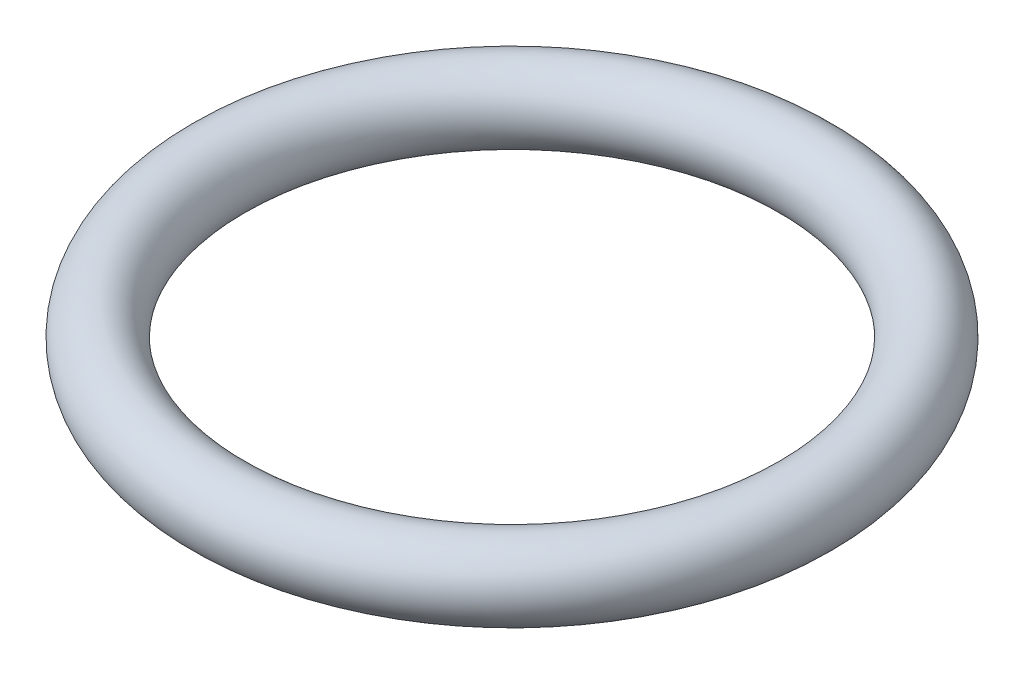
from build123d import *

# Parameters (mm, degrees)
SKETCH2_R = 1.78


with BuildPart() as part:
    # Sketch2 → Revolve1 (revolve)
    with BuildSketch(Plane.XY, mode=Mode.PRIVATE) as revolve1_sk:
        with Locations((14.26, 0)):
            Circle(SKETCH2_R)
    revolve(revolve1_sk.sketch.rotate(Axis((0, 4.996607078, 0), (0, -1, 0)), 180), axis=Axis((0, 4.996607078, 0), (0, -1, 0)))


solid = part.part
